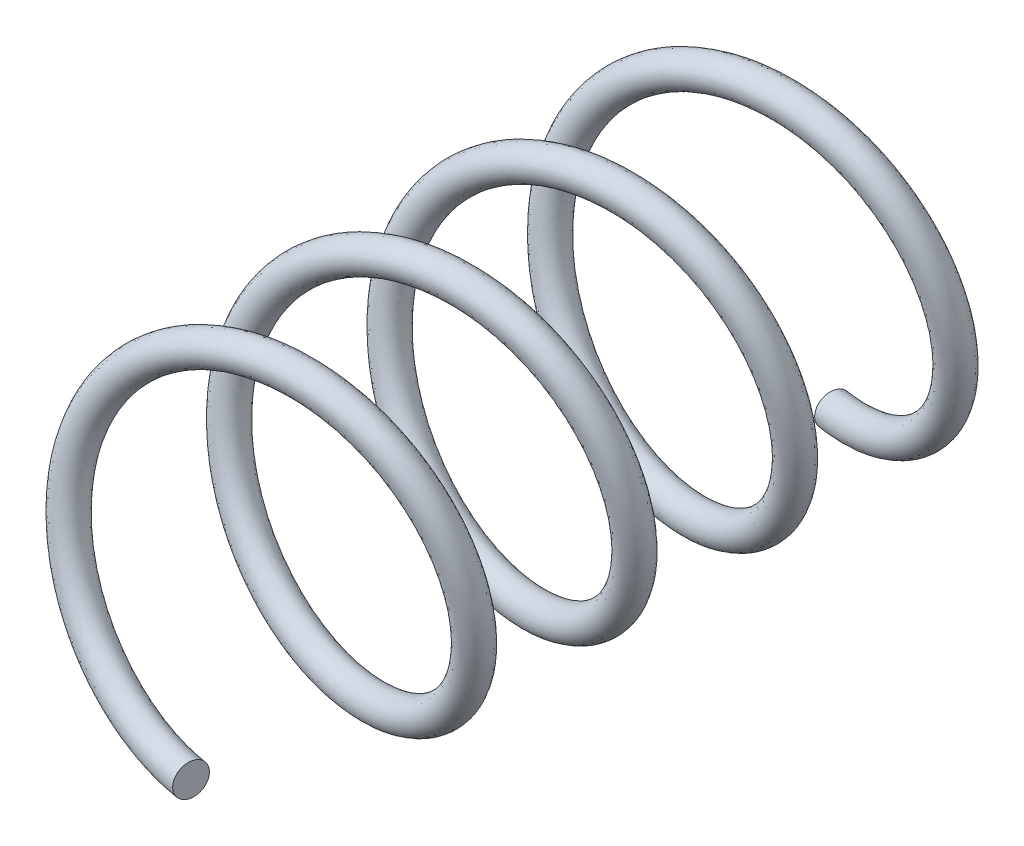
from build123d import *

# Parameters (mm, degrees)
BARRER1_PITCH       = 10
BARRER1_HEIGHT      = 40
BARRER1_RADIUS      = 10
BARRER1_START_ANGLE = -90
BARRER1_PROFILE_R   = 1


with BuildPart() as part:
    # Barrer1: sweep along a helix
    with BuildLine() as barrer1_path:
        add(Helix(BARRER1_PITCH, BARRER1_HEIGHT, BARRER1_RADIUS, center=(0, 0, 0), direction=(0, 0, -1), mode=Mode.PRIVATE).rotate(Axis((0, 0, 0), (0, 0, -1)), BARRER1_START_ANGLE))
    # Barrer1 profile (on start of the path) → Barrer1 (sweep)
    with BuildSketch(Plane(origin=(0, -10, 0), x_dir=(0.15717672547755349, 0, -0.9875704921513977), z_dir=(-0.9875704921513977, -2.8861080908017144e-13, -0.15717672547755349))):
        Circle(BARRER1_PROFILE_R)
    sweep(path=barrer1_path.line, is_frenet=True)


solid = part.part
